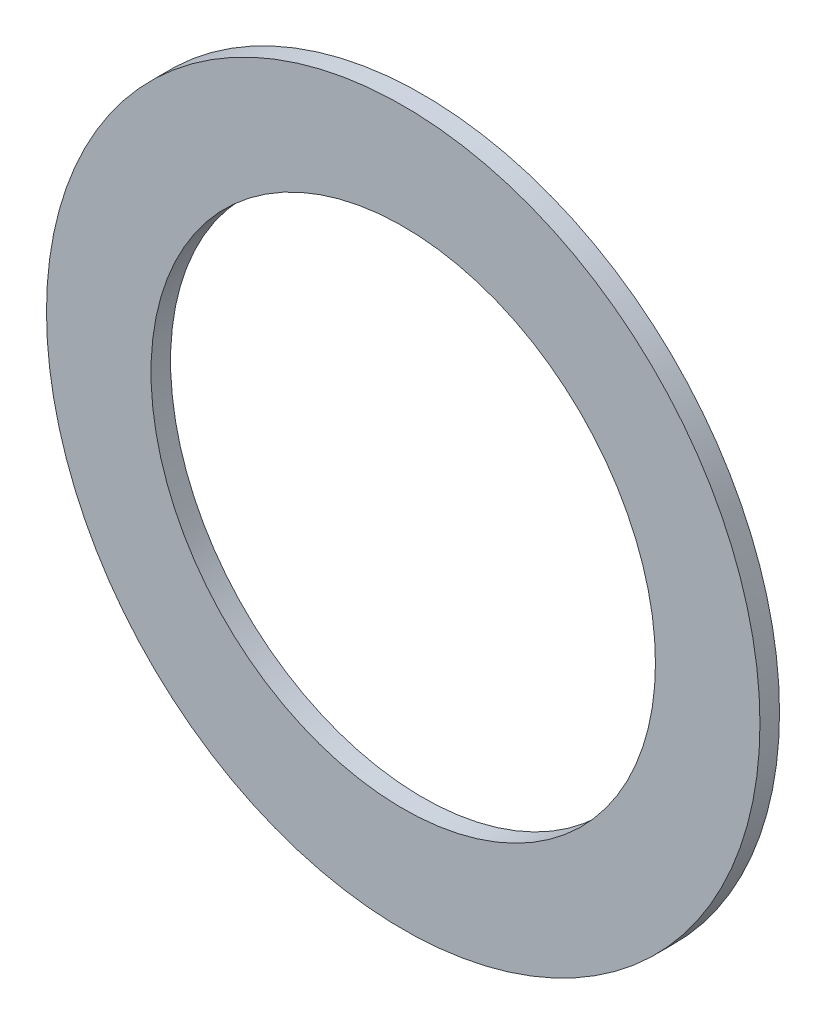
from build123d import *

# Parameters (mm, degrees)
SKETCH1_R           = 73
SKETCH1_R_2         = 51.6125
BOSS_EXTRUDE1_DEPTH = 4


with BuildPart() as part:
    # Sketch1 → Boss-Extrude1 (new body)
    with BuildSketch(Plane.XY):
        Circle(SKETCH1_R)
        Circle(SKETCH1_R_2, mode=Mode.SUBTRACT)
    extrude(amount=BOSS_EXTRUDE1_DEPTH)


solid = part.part
